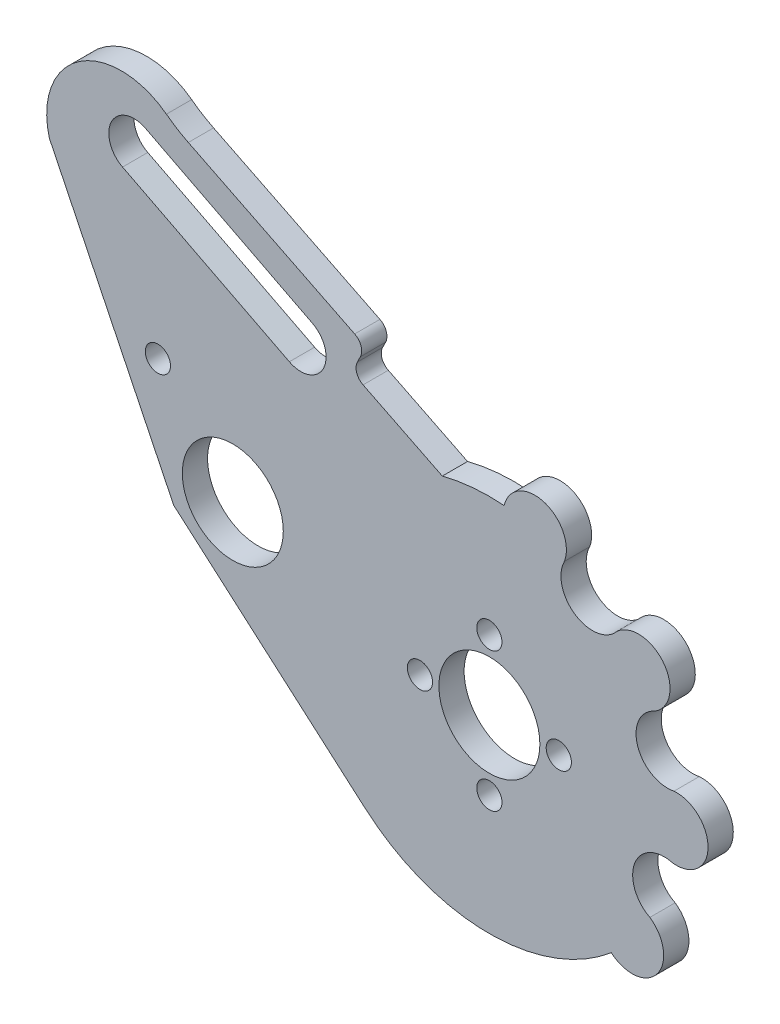
from build123d import *

# Parameters (mm, degrees)
ESQUISSE1_R        = 4
ESQUISSE1_R_2      = 1
BOSS_EXTRU_1_DEPTH = 2
CONG_1_R           = 1
CONG_2_R           = 11


with BuildPart() as part:
    # Esquisse1 → Boss.-Extru.1 (new body)
    with BuildSketch(Plane.XY):
        with BuildLine():
            Line((-3.728432128, 14.529239273), (-10.902133324, 18.092613259))
            Line((-10.902133324, 18.092613259), (-9.77414371, 20.363455577))
            Line((-9.77414371, 20.363455577), (-25.005281494, 27.929179137))
            ThreePointArc((-25.005281494, 27.929179137), (-32.144223962, 28.809157948), (-34.856074883, 22.146971607))
            Line((-34.856074883, 22.146971607), (-25.005281494, 1.884444499))
            Line((-25.005281494, 1.884444499), (-9.850606554, -11.31218593))
            ThreePointArc((-9.850606554, -11.31218593), (-0.12474397, -14.999481289), (9.661100255, -11.47445606))
            ThreePointArc((9.661100255, -11.47445606), (13.285456142, -11.120563185), (12.711512496, -7.524484146))
            ThreePointArc((12.711512496, -7.524484146), (11.513856086, -4.40486723), (14.487891216, -2.881218443))
            ThreePointArc((14.487891216, -2.881218443), (17.321259352, -0.471730027), (14.623234656, 2.088401251))
            ThreePointArc((14.623234656, 2.088401251), (11.736537034, 3.771662198), (13.102212542, 6.821468911))
            ThreePointArc((13.102212542, 6.821468911), (13.803708164, 10.474072546), (10.097110191, 10.781872629))
            ThreePointArc((10.097110191, 10.781872629), (6.792233583, 10.287725708), (5.948313856, 13.521019705))
            ThreePointArc((5.948313856, 13.521019705), (4.31988032, 16.778227095), (1.167882396, 14.954465912))
            ThreePointArc((1.167882396, 14.954465912), (-1.297808983, 14.94375093), (-3.728432128, 14.529239273))
        make_face()
        with Locations((-20.325227829, 4.439090716)):
            Circle(ESQUISSE1_R, mode=Mode.SUBTRACT)
        with Locations((-26.256387143, 11.319323515)):
            Circle(ESQUISSE1_R_2, mode=Mode.SUBTRACT)
        with BuildLine():
            ThreePointArc((-29.058075564, 23.063121212), (-29.928943128, 25.754141406), (-27.237922934, 26.625008971))
            Line((-27.237922934, 26.625008971), (-14.025891569, 19.873557138))
            ThreePointArc((-14.025891569, 19.873557138), (-13.155024005, 17.182536944), (-15.846044199, 16.31166938))
            Line((-15.846044199, 16.31166938), (-29.058075564, 23.063121212))
        make_face(mode=Mode.SUBTRACT)
        with Locations((5.5, 0)):
            Circle(ESQUISSE1_R_2, mode=Mode.SUBTRACT)
        with Locations((0, -5.5)):
            Circle(ESQUISSE1_R_2, mode=Mode.SUBTRACT)
        with Locations((-5.5, 0)):
            Circle(ESQUISSE1_R_2, mode=Mode.SUBTRACT)
        Circle(ESQUISSE1_R, mode=Mode.SUBTRACT)
        with Locations((0, 5.5)):
            Circle(ESQUISSE1_R_2, mode=Mode.SUBTRACT)
    extrude(amount=BOSS_EXTRU_1_DEPTH)

    # Congé1
    cong_1_edges = [part.edges().sort_by_distance(p)[0] for p in [
        (-9.77414371, 20.363455577, 1),
        (-10.902133324, 18.092613259, 1),
    ]]
    fillet(cong_1_edges, radius=CONG_1_R)

    # Congé2
    cong_2_edges = [part.edges().sort_by_distance(p)[0] for p in [
        (-25.005281494, 27.929179137, 1),
    ]]
    fillet(cong_2_edges, radius=CONG_2_R)


solid = part.part
